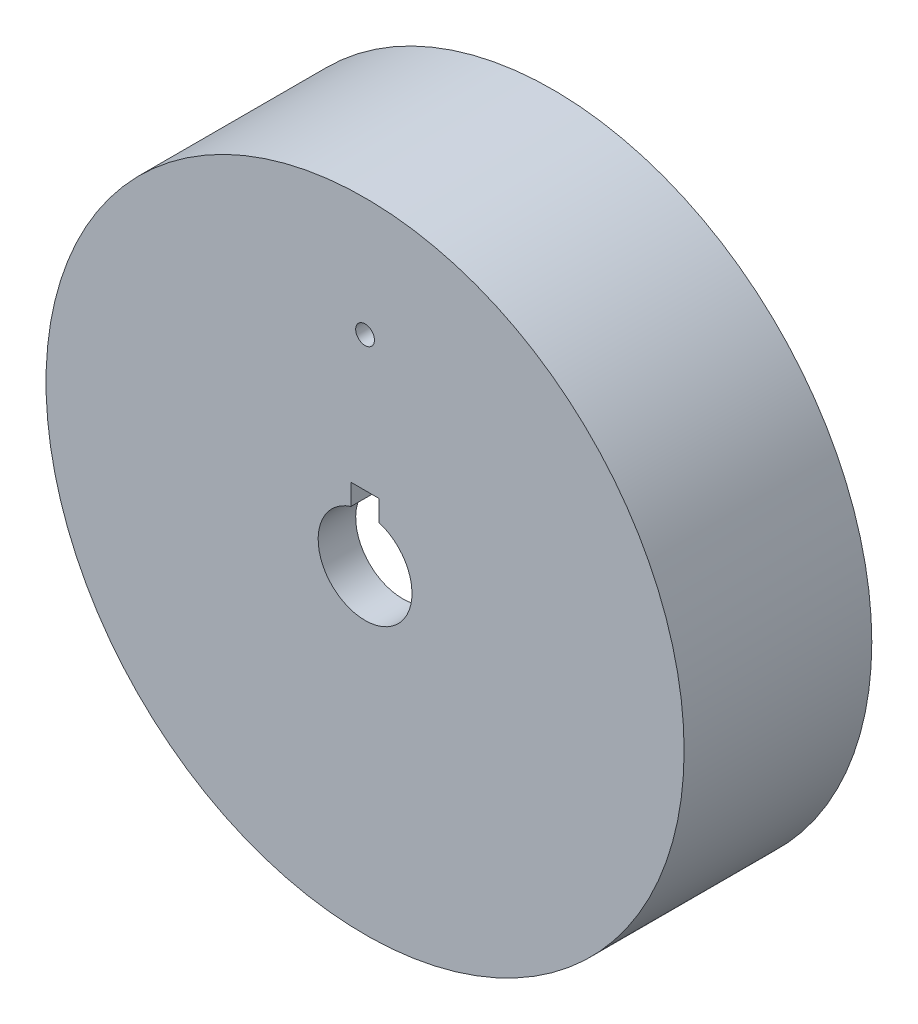
from build123d import *

# Parameters (mm, degrees)
CROQUIS2_R                                           = 170
CROQUIS2_R_2                                         = 150
CROQUIS2_R_3                                         = 67.5
CROQUIS2_R_4                                         = 25
SALIENTE_EXTRUIR1_DEPTH                              = 100
CROQUIS3_R                                           = 150
CORTAR_EXTRUIR1_DEPTH                                = 50
CROQUIS4_R                                           = 67.5
CORTAR_EXTRUIR3_DEPTH                                = 80
CROQUIS5_W                                           = 15
CROQUIS5_H                                           = 35
CORTAR_EXTRUIR4_DEPTH                                = 261.384331326
AVELLANADO_PARA_TORNILLO_CON_CABEZA_AVEL_D           = 10
AVELLANADO_PARA_TORNILLO_CON_CABEZA_AVEL_CSINK_D     = 17.3
AVELLANADO_PARA_TORNILLO_CON_CABEZA_AVEL_CSINK_ANGLE = 90


with BuildPart() as part:
    # Croquis2 → Saliente-Extruir1 (new body)
    # profile 1 of 3: a face of its own
    with BuildSketch(Plane.XY):
        Circle(CROQUIS2_R)
        Circle(CROQUIS2_R_2, mode=Mode.SUBTRACT)
    # profile 2 of 3: a face of its own
    with BuildSketch(Plane.XY):
        Circle(CROQUIS2_R_2)
        Circle(CROQUIS2_R_3, mode=Mode.SUBTRACT)
    # profile 3 of 3: a face of its own
    with BuildSketch(Plane.XY):
        Circle(CROQUIS2_R_3)
        Circle(CROQUIS2_R_4, mode=Mode.SUBTRACT)
    extrude(amount=SALIENTE_EXTRUIR1_DEPTH)

    # Croquis3 → Cortar-Extruir1 (cut)
    with BuildSketch(Plane.XY):
        Circle(CROQUIS3_R)
    extrude(amount=CORTAR_EXTRUIR1_DEPTH, mode=Mode.SUBTRACT)

    # Croquis4 → Cortar-Extruir3 (cut)
    with BuildSketch(Plane.XY):
        Circle(CROQUIS4_R)
    extrude(amount=CORTAR_EXTRUIR3_DEPTH, mode=Mode.SUBTRACT)

    # Croquis5 → Cortar-Extruir4 (cut, through all)
    with BuildSketch(Plane.XY):
        with Locations((0, 17.5)):
            Rectangle(CROQUIS5_W, CROQUIS5_H)
    extrude(amount=CORTAR_EXTRUIR4_DEPTH, mode=Mode.SUBTRACT)

    # Avellanado para tornillo con cabeza avellanada de M81 (through all)
    with Locations(Plane(origin=(0, 0, 50), x_dir=(-1, 0, 0), z_dir=(0, 0, -1))):
        with Locations((0, 106.839777093)):
            CounterSinkHole(AVELLANADO_PARA_TORNILLO_CON_CABEZA_AVEL_D / 2, AVELLANADO_PARA_TORNILLO_CON_CABEZA_AVEL_CSINK_D / 2, counter_sink_angle=AVELLANADO_PARA_TORNILLO_CON_CABEZA_AVEL_CSINK_ANGLE)


solid = part.part
